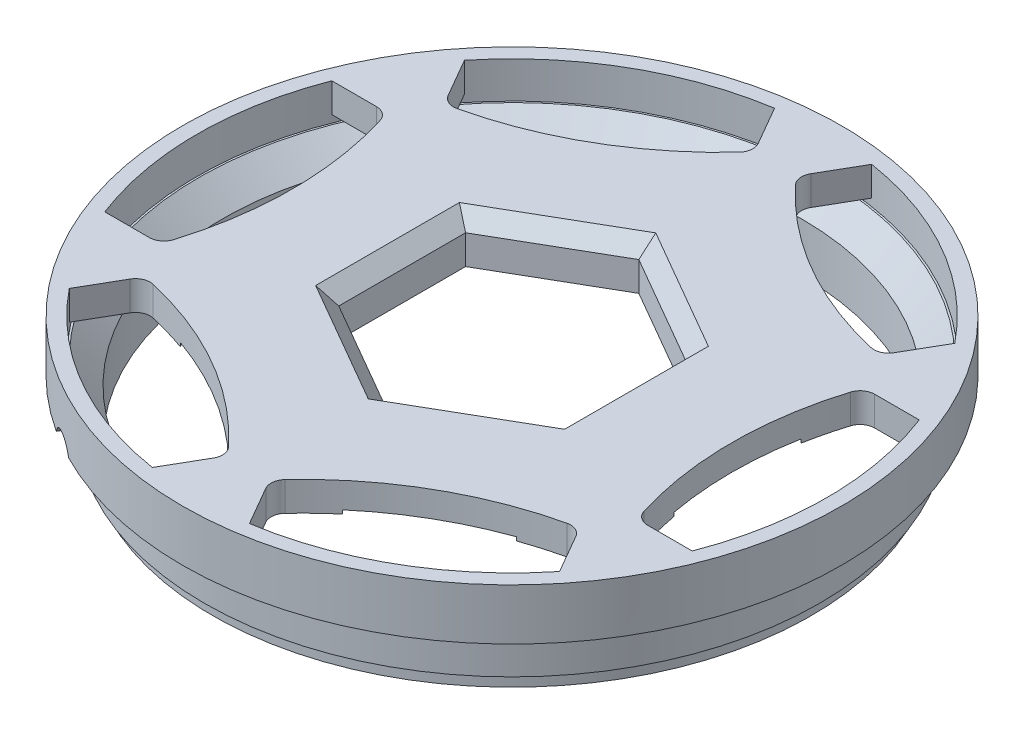
from build123d import *

# Parameters (mm, degrees)
SKIZZE1_R                             = 44
AUFSATZ_LINEAR_AUSTRAGEN1_DEPTH       = 4
SCHNITT_LINEAR_START                  = -10
SCHNITT_LINEAR_AUSTRAGEN2_DEPTH       = 10
KREISMUSTER1_COUNT                    = 6
SCHNITT_LINEAR_AUSTRAGEN3_DEPTH       = 4
SCHNITT_LINEAR_AUSTRAGEN3_DEPTH_BACK  = 10
VERRUNDUNG1_R                         = 2
SKIZZE7_R                             = 32
SCHNITT_LINEAR_AUSTRAGEN7_DEPTH       = 0.5
SKIZZE8_R                             = 45
SKIZZE8_R_2                           = 43
AUFSATZ_LINEAR_AUSTRAGEN2_DEPTH       = 6
AUFSATZ_LINEAR_AUSTRAGEN3_DEPTH       = 9
AUFSATZ_LINEAR_AUSTRAGEN3_DEPTH_BACK  = 1
SKIZZE9_R                             = 45
SKIZZE9_R_2                           = 39.5
SKIZZE4_R                             = 21.007106764
AUFSATZ_LINEAR_AUSTRAGEN8_DEPTH       = 6
FASE1_SIZE                            = 3.25
SKIZZE10_R                            = 50
SKIZZE10_R_2                          = 42
SCHNITT_LINEAR_AUSTRAGEN9_DEPTH       = 8
SKIZZE11_R                            = 50
SKIZZE11_R_2                          = 40.9
SCHNITT_LINEAR_AUSTRAGEN10_DEPTH      = 2
SCHNITT_LINEAR_AUSTRAGEN11_DEPTH      = 6
SCHNITT_LINEAR_AUSTRAGEN11_DEPTH_BACK = 6
FASE3_SIZE                            = 2
FASE5_SIZE                            = 2
SKIZZE12_R                            = 2.5
SCHNITT_LINEAR_AUSTRAGEN12_DEPTH      = 79.994520679
VERRUNDUNG2_R                         = 1


with BuildPart() as part:
    # Skizze1 → Aufsatz-Linear austragen1 (new body)
    with BuildSketch(Plane(origin=(0, 0, 0), x_dir=(1, 0, 0), z_dir=(0, 1, 0))):
        Circle(SKIZZE1_R)
    extrude(amount=AUFSATZ_LINEAR_AUSTRAGEN1_DEPTH)

    # Skizze2 → Schnitt-Linear austragen2 (cut)
    with BuildSketch(Plane(origin=(0, 4, 0), x_dir=(1, 0, 0), z_dir=(0, 1, 0)).offset(SCHNITT_LINEAR_START)):
        with BuildLine():
            ThreePointArc((-30, 0), (-30.647234858, 7.855929826), (-32.571484726, 15.5))
            Line((-32.571484726, 15.5), (-41.179485184, 15.5))
            ThreePointArc((-41.179485184, 15.5), (-44, 0), (-41.179485184, -15.5))
            Line((-41.179485184, -15.5), (-32.571484726, -15.5))
            ThreePointArc((-32.571484726, -15.5), (-30.647234858, -7.855929826), (-30, 0))
        make_face()
    schnitt_linear_austragen2 = extrude(amount=SCHNITT_LINEAR_AUSTRAGEN2_DEPTH, mode=Mode.SUBTRACT)

    # Kreismuster1: Schnitt-Linear austragen2 ×6 about axis
    kreismuster1_axis = Axis((0, 0, 0), (0, 1, 0))
    for i in range(1, KREISMUSTER1_COUNT):
        add(schnitt_linear_austragen2.rotate(kreismuster1_axis, i * 360 / KREISMUSTER1_COUNT), mode=Mode.SUBTRACT)

    # Skizze3 → Schnitt-Linear austragen3 (cut, two sides: drawn at the far end of the back side and taken through both)
    with BuildSketch(Plane.XZ.offset(-SCHNITT_LINEAR_AUSTRAGEN3_DEPTH_BACK)):
        Polygon((15, 8.660254038), (0, 17.320508076), (-15, 8.660254038), (-15, -8.660254038), (0, -17.320508076), (15, -8.660254038), align=None)
    extrude(amount=SCHNITT_LINEAR_AUSTRAGEN3_DEPTH + SCHNITT_LINEAR_AUSTRAGEN3_DEPTH_BACK, mode=Mode.SUBTRACT)

    # Verrundung1
    verrundung1_edges = [part.edges().sort_by_distance(p)[0] for p in [
        (-32.571484726, 2, 15.5),
        (-2.862348604, 2, 35.957733212),
        (2.862348604, 2, 35.957733212),
        (29.709136122, 2, 20.457733212),
        (32.571484726, 2, 15.5),
        (32.571484726, 2, -15.5),
        (29.709136122, 2, -20.457733212),
        (2.862348604, 2, -35.957733212),
        (-2.862348604, 2, -35.957733212),
        (-29.709136122, 2, -20.457733212),
        (-32.571484726, 2, -15.5),
        (-29.709136122, 2, 20.457733212),
    ]]
    fillet(verrundung1_edges, radius=VERRUNDUNG1_R)

    # Skizze7 → Schnitt-Linear austragen7 (cut)
    with BuildSketch(Plane.XZ):
        Circle(SKIZZE7_R)
    extrude(amount=-SCHNITT_LINEAR_AUSTRAGEN7_DEPTH, mode=Mode.SUBTRACT)

    # Skizze8 → Aufsatz-Linear austragen2 (add)
    with BuildSketch(Plane(origin=(0, 4, 0), x_dir=(1, 0, 0), z_dir=(0, 1, 0))):
        Circle(SKIZZE8_R)
        Circle(SKIZZE8_R_2, mode=Mode.SUBTRACT)
    extrude(amount=-AUFSATZ_LINEAR_AUSTRAGEN2_DEPTH)



with BuildPart() as body_2:
    # Skizze9 → Aufsatz-Linear austragen3 (new, two sides: drawn at the far end of the back side and taken through both)
    with BuildSketch(Plane.XZ.offset(2).offset(-AUFSATZ_LINEAR_AUSTRAGEN3_DEPTH_BACK)):
        Circle(SKIZZE9_R)
        Circle(SKIZZE9_R_2, mode=Mode.SUBTRACT)
    extrude(amount=AUFSATZ_LINEAR_AUSTRAGEN3_DEPTH + AUFSATZ_LINEAR_AUSTRAGEN3_DEPTH_BACK)


with BuildPart() as part_1:
    add(part.part)

    add(body_2.part)  # Aufsatz-Linear austragen8 merges body 2
    # Skizze4 → Aufsatz-Linear austragen8 (add)
    with BuildSketch(Plane(origin=(0, 4, 0), x_dir=(1, 0, 0), z_dir=(0, 1, 0))):
        Circle(SKIZZE4_R)
    extrude(amount=-AUFSATZ_LINEAR_AUSTRAGEN8_DEPTH)

    # Fase1
    fase1_edges = [part_1.edges().sort_by_distance(p)[0] for p in [
        (-39.5, -1, 0),
    ]]
    chamfer(fase1_edges, length=FASE1_SIZE)

    # Skizze10 → Schnitt-Linear austragen9 (cut)
    with BuildSketch(Plane.XZ.offset(11)):
        Circle(SKIZZE10_R)
        Circle(SKIZZE10_R_2, mode=Mode.SUBTRACT)
    extrude(amount=-SCHNITT_LINEAR_AUSTRAGEN9_DEPTH, mode=Mode.SUBTRACT)

    # Skizze11 → Schnitt-Linear austragen10 (cut)
    with BuildSketch(Plane.XZ.offset(11)):
        with Locations((-1.948563864, 1.772578218)):
            Circle(SKIZZE11_R)
        Circle(SKIZZE11_R_2, mode=Mode.SUBTRACT)
    extrude(amount=-SCHNITT_LINEAR_AUSTRAGEN10_DEPTH, mode=Mode.SUBTRACT)

    # Skizze3<3> → Schnitt-Linear austragen11 (cut, two sides: drawn at the far end of the back side and taken through both)
    with BuildSketch(Plane.XZ.offset(-SCHNITT_LINEAR_AUSTRAGEN11_DEPTH_BACK)):
        Polygon((15, 8.660254038), (0, 17.320508076), (-15, 8.660254038), (-15, -8.660254038), (0, -17.320508076), (15, -8.660254038), align=None)
    extrude(amount=SCHNITT_LINEAR_AUSTRAGEN11_DEPTH + SCHNITT_LINEAR_AUSTRAGEN11_DEPTH_BACK, mode=Mode.SUBTRACT)

    # Fase3
    fase3_edges = [part_1.edges().sort_by_distance(p)[0] for p in [
        (-21.007106764, -2, 0),
    ]]
    chamfer(fase3_edges, length=FASE3_SIZE)

    # Fase5
    fase5_edges = [part_1.edges().sort_by_distance(p)[0] for p in [
        (-7.5, 4, 12.990381057),
        (7.5, 4, 12.990381057),
        (15, 4, 0),
        (7.5, 4, -12.990381057),
        (-7.5, 4, -12.990381057),
        (-15, 4, 0),
    ]]
    chamfer(fase5_edges, length=FASE5_SIZE)

    # Skizze12 → Schnitt-Linear austragen12 (cut, through all)
    with BuildSketch(Plane(origin=(-7.5, 0, 12.990381057), x_dir=(-0.8660254037844387, 0, -0.49999999999999994), z_dir=(0.4999999999999999, 0, -0.8660254037844386))):
        with Locations((0, -4)):
            Circle(SKIZZE12_R)
    extrude(amount=-SCHNITT_LINEAR_AUSTRAGEN12_DEPTH, mode=Mode.SUBTRACT)

    # Verrundung2
    verrundung2_edges = [part_1.edges().sort_by_distance(p)[0] for p in [
        (-19.999653894, -3, -36.93255805),
    ]]
    fillet(verrundung2_edges, radius=VERRUNDUNG2_R)


solid = part_1.part
